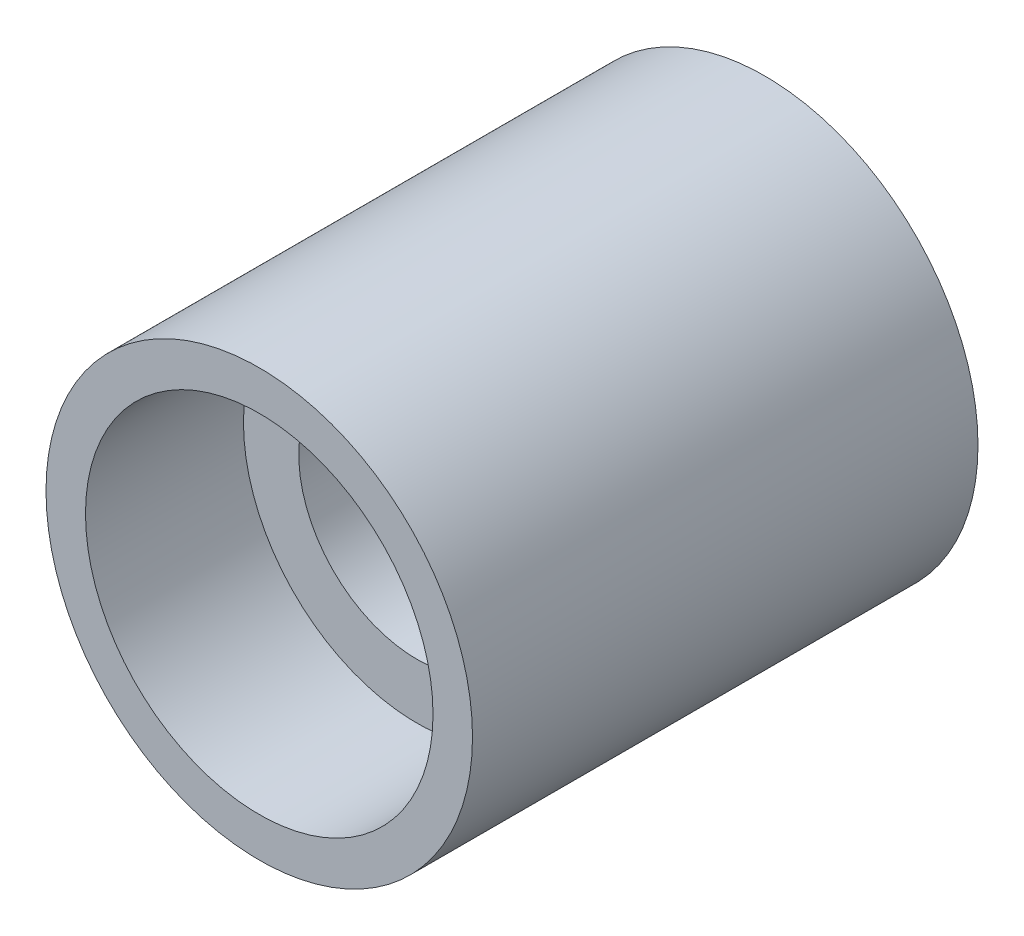
from build123d import *

# Parameters (mm, degrees)
SKETCH2_R           = 13.5
BOSS_EXTRUDE1_DEPTH = 32
SKETCH4_R           = 11
CUT_EXTRUDE1_DEPTH  = 10
SKETCH5_R           = 7.5
CUT_EXTRUDE2_DEPTH  = 30


with BuildPart() as part:
    # Sketch2 → Boss-Extrude1 (new body)
    with BuildSketch(Plane.XY):
        Circle(SKETCH2_R)
    extrude(amount=-BOSS_EXTRUDE1_DEPTH)

    # Sketch4 → Cut-Extrude1 (cut)
    with BuildSketch(Plane.XY):
        Circle(SKETCH4_R)
    extrude(amount=-CUT_EXTRUDE1_DEPTH, mode=Mode.SUBTRACT)

    # Sketch5 → Cut-Extrude2 (cut)
    with BuildSketch(Plane.XY):
        Circle(SKETCH5_R)
    extrude(amount=-CUT_EXTRUDE2_DEPTH, mode=Mode.SUBTRACT)


solid = part.part
